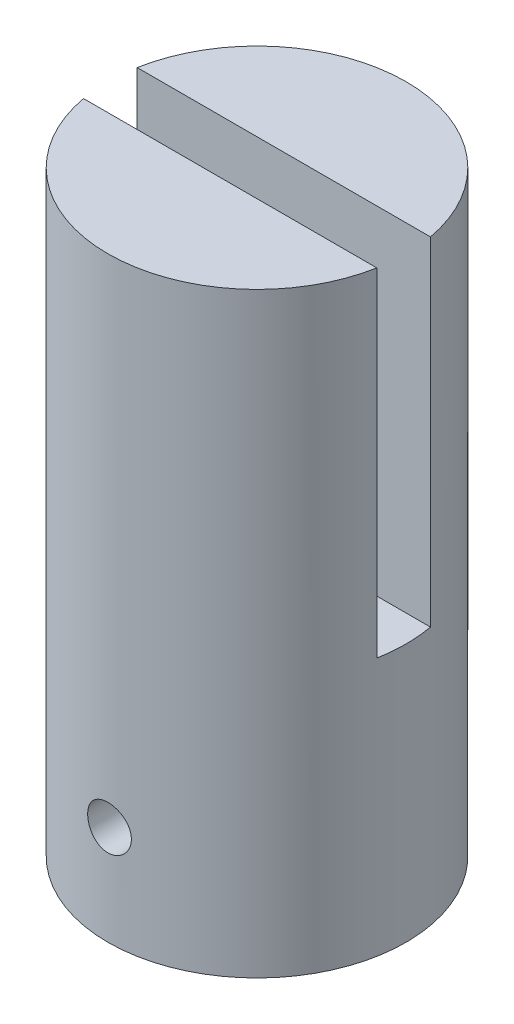
from build123d import *

# Parameters (mm, degrees)
SKETCH1_R               = 7.5
SKETCH1_R_2             = 2.5
BOSS_EXTRUDE1_DEPTH     = 10
BOSS_EXTRUDE2_START     = 20
SKETCH1_3_R             = 7.5
BOSS_EXTRUDE2_DEPTH     = 20
CUT_EXTRUDE1_DEPTH      = 17
CUT_EXTRUDE2_DEPTH      = 23.638462845
CUT_EXTRUDE2_DEPTH_BACK = 23.638462845
SKETCH3_R               = 1.1


with BuildPart() as part:
    # Sketch1 → Boss-Extrude1 (new body)
    with BuildSketch(Plane(origin=(0, 0, 0), x_dir=(1, 0, 0), z_dir=(0, 1, 0))):
        Circle(SKETCH1_R)
        Circle(SKETCH1_R_2, mode=Mode.SUBTRACT)
    extrude(amount=-BOSS_EXTRUDE1_DEPTH)

    # Sketch1<3> → Boss-Extrude2 (add)
    with BuildSketch(Plane(origin=(0, 0, 0), x_dir=(1, 0, 0), z_dir=(0, 1, 0)).offset(BOSS_EXTRUDE2_START)):
        Circle(SKETCH1_3_R)
    extrude(amount=-BOSS_EXTRUDE2_DEPTH)

    # Sketch2 → Cut-Extrude1 (cut)
    with BuildSketch(Plane(origin=(0, 20, 0), x_dir=(1, 0, 0), z_dir=(0, 1, 0))):
        with BuildLine():
            Line((-7.377499576, 1.35), (7.377499576, 1.35))
            ThreePointArc((7.377499576, 1.35), (7.5, 0), (7.377499576, -1.35))
            Line((7.377499576, -1.35), (-7.377499576, -1.35))
            ThreePointArc((-7.377499576, -1.35), (-7.5, 0), (-7.377499576, 1.35))
        make_face()
    extrude(amount=-CUT_EXTRUDE1_DEPTH, mode=Mode.SUBTRACT)

    # Sketch3 → Cut-Extrude2 (cut, two sides: drawn at the far end of the back side and taken through both)
    with BuildSketch(Plane.XY.offset(-CUT_EXTRUDE2_DEPTH_BACK)):
        with Locations((0, -5)):
            Circle(SKETCH3_R)
    extrude(amount=CUT_EXTRUDE2_DEPTH + CUT_EXTRUDE2_DEPTH_BACK, mode=Mode.SUBTRACT)


solid = part.part
